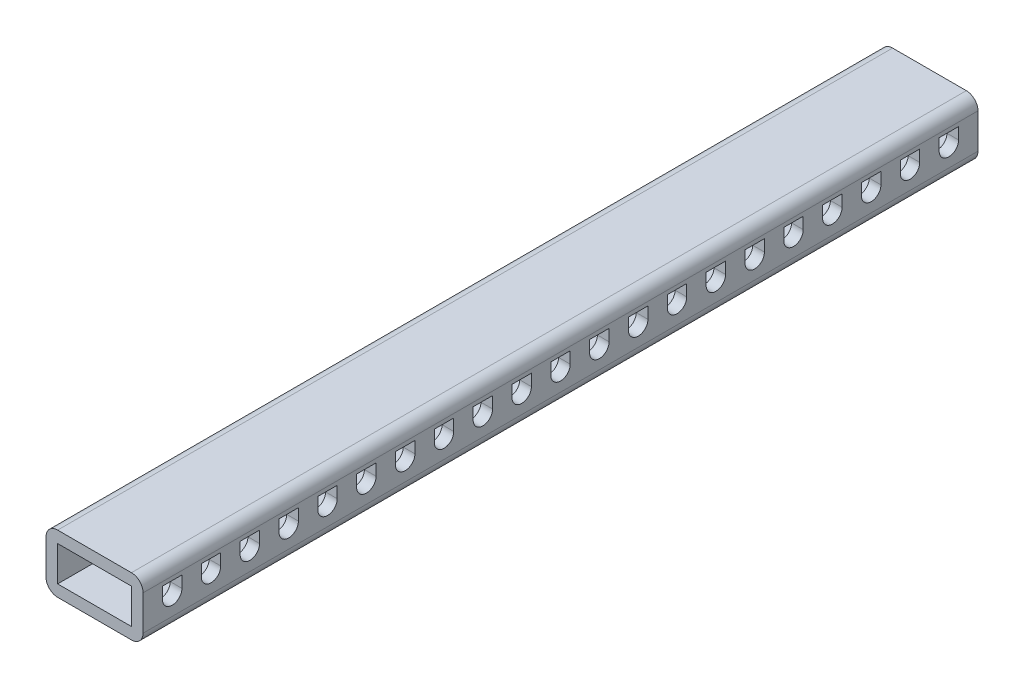
from build123d import *

# Parameters (mm, degrees)
SKETCH1_W           = 25
SKETCH1_H           = 15
BOSS_EXTRUDE1_DEPTH = 215
SKETCH2_W           = 19
SKETCH2_H           = 9
CUT_EXTRUDE1_DEPTH  = 263
CUT_EXTRUDE2_DEPTH  = 263
FILLET1_R           = 3


with BuildPart() as part:
    # Sketch1 → Boss-Extrude1 (new body)
    with BuildSketch(Plane.XY):
        Rectangle(SKETCH1_W, SKETCH1_H)
    extrude(amount=BOSS_EXTRUDE1_DEPTH)

    # Sketch2 → Cut-Extrude1 (cut)
    with BuildSketch(Plane.XY.offset(215)):
        Rectangle(SKETCH2_W, SKETCH2_H)
    extrude(amount=-CUT_EXTRUDE1_DEPTH, mode=Mode.SUBTRACT)

    # Sketch3 → Cut-Extrude2 (cut)
    with BuildSketch(Plane(origin=(12.5, 0, 0), x_dir=(0, 0, -1), z_dir=(1, 0, 0))):
        with BuildLine():
            Line((-210, 3.5), (-210, 0.5))
            ThreePointArc((-210, 0.5), (-207.5, -2), (-205, 0.5))
            Line((-205, 0.5), (-205, 3.5))
            Line((-205, 3.5), (-210, 3.5))
        make_face()
        with BuildLine():
            ThreePointArc((-195, 0.5), (-197.5, -2), (-200, 0.5))
            Line((-200, 0.5), (-200, 3.5))
            Line((-200, 3.5), (-195, 3.5))
            Line((-195, 3.5), (-195, 0.5))
        make_face()
        with BuildLine():
            Line((-190, 3.5), (-190, 0.5))
            ThreePointArc((-190, 0.5), (-187.5, -2), (-185, 0.5))
            Line((-185, 0.5), (-185, 3.5))
            Line((-185, 3.5), (-190, 3.5))
        make_face()
        with BuildLine():
            ThreePointArc((-175, 0.5), (-177.5, -2), (-180, 0.5))
            Line((-180, 0.5), (-180, 3.5))
            Line((-180, 3.5), (-175, 3.5))
            Line((-175, 3.5), (-175, 0.5))
        make_face()
        with BuildLine():
            Line((-170, 3.5), (-170, 0.5))
            ThreePointArc((-170, 0.5), (-167.5, -2), (-165, 0.5))
            Line((-165, 0.5), (-165, 3.5))
            Line((-165, 3.5), (-170, 3.5))
        make_face()
        with BuildLine():
            ThreePointArc((-155, 0.5), (-157.5, -2), (-160, 0.5))
            Line((-160, 0.5), (-160, 3.5))
            Line((-160, 3.5), (-155, 3.5))
            Line((-155, 3.5), (-155, 0.5))
        make_face()
        with BuildLine():
            Line((-150, 3.5), (-150, 0.5))
            ThreePointArc((-150, 0.5), (-147.5, -2), (-145, 0.5))
            Line((-145, 0.5), (-145, 3.5))
            Line((-145, 3.5), (-150, 3.5))
        make_face()
        with BuildLine():
            ThreePointArc((-135, 0.5), (-137.5, -2), (-140, 0.5))
            Line((-140, 0.5), (-140, 3.5))
            Line((-140, 3.5), (-135, 3.5))
            Line((-135, 3.5), (-135, 0.5))
        make_face()
        with BuildLine():
            Line((-130, 3.5), (-130, 0.5))
            ThreePointArc((-130, 0.5), (-127.5, -2), (-125, 0.5))
            Line((-125, 0.5), (-125, 3.5))
            Line((-125, 3.5), (-130, 3.5))
        make_face()
        with BuildLine():
            ThreePointArc((-115, 0.5), (-117.5, -2), (-120, 0.5))
            Line((-120, 0.5), (-120, 3.5))
            Line((-120, 3.5), (-115, 3.5))
            Line((-115, 3.5), (-115, 0.5))
        make_face()
        with BuildLine():
            Line((-110, 3.5), (-110, 0.5))
            ThreePointArc((-110, 0.5), (-107.5, -2), (-105, 0.5))
            Line((-105, 0.5), (-105, 3.5))
            Line((-105, 3.5), (-110, 3.5))
        make_face()
        with BuildLine():
            ThreePointArc((-95, 0.5), (-97.5, -2), (-100, 0.5))
            Line((-100, 0.5), (-100, 3.5))
            Line((-100, 3.5), (-95, 3.5))
            Line((-95, 3.5), (-95, 0.5))
        make_face()
        with BuildLine():
            Line((-90, 3.5), (-90, 0.5))
            ThreePointArc((-90, 0.5), (-87.5, -2), (-85, 0.5))
            Line((-85, 0.5), (-85, 3.5))
            Line((-85, 3.5), (-90, 3.5))
        make_face()
        with BuildLine():
            ThreePointArc((-75, 0.5), (-77.5, -2), (-80, 0.5))
            Line((-80, 0.5), (-80, 3.5))
            Line((-80, 3.5), (-75, 3.5))
            Line((-75, 3.5), (-75, 0.5))
        make_face()
        with BuildLine():
            Line((-70, 3.5), (-70, 0.5))
            ThreePointArc((-70, 0.5), (-67.5, -2), (-65, 0.5))
            Line((-65, 0.5), (-65, 3.5))
            Line((-65, 3.5), (-70, 3.5))
        make_face()
        with BuildLine():
            ThreePointArc((-55, 0.5), (-57.5, -2), (-60, 0.5))
            Line((-60, 0.5), (-60, 3.5))
            Line((-60, 3.5), (-55, 3.5))
            Line((-55, 3.5), (-55, 0.5))
        make_face()
        with BuildLine():
            Line((-50, 3.5), (-50, 0.5))
            ThreePointArc((-50, 0.5), (-47.5, -2), (-45, 0.5))
            Line((-45, 0.5), (-45, 3.5))
            Line((-45, 3.5), (-50, 3.5))
        make_face()
        with BuildLine():
            ThreePointArc((-35, 0.5), (-37.5, -2), (-40, 0.5))
            Line((-40, 0.5), (-40, 3.5))
            Line((-40, 3.5), (-35, 3.5))
            Line((-35, 3.5), (-35, 0.5))
        make_face()
        with BuildLine():
            Line((-30, 3.5), (-30, 0.5))
            ThreePointArc((-30, 0.5), (-27.5, -2), (-25, 0.5))
            Line((-25, 0.5), (-25, 3.5))
            Line((-25, 3.5), (-30, 3.5))
        make_face()
        with BuildLine():
            ThreePointArc((-15, 0.5), (-17.5, -2), (-20, 0.5))
            Line((-20, 0.5), (-20, 3.5))
            Line((-20, 3.5), (-15, 3.5))
            Line((-15, 3.5), (-15, 0.5))
        make_face()
        with BuildLine():
            Line((-10, 3.5), (-10, 0.5))
            ThreePointArc((-10, 0.5), (-7.5, -2), (-5, 0.5))
            Line((-5, 0.5), (-5, 3.5))
            Line((-5, 3.5), (-10, 3.5))
        make_face()
        with BuildLine():
            ThreePointArc((5, 0.5), (2.5, -2), (0, 0.5))
            Line((0, 0.5), (0, 3.5))
            Line((0, 3.5), (5, 3.5))
            Line((5, 3.5), (5, 0.5))
        make_face()
    extrude(amount=-CUT_EXTRUDE2_DEPTH, mode=Mode.SUBTRACT)

    # Fillet1
    fillet1_edges = [part.edges().sort_by_distance(p)[0] for p in [
        (12.5, -7.5, 107.5),
        (-12.5, -7.5, 107.5),
        (-12.5, 7.5, 107.5),
        (12.5, 7.5, 107.5),
    ]]
    fillet(fillet1_edges, radius=FILLET1_R)


solid = part.part
